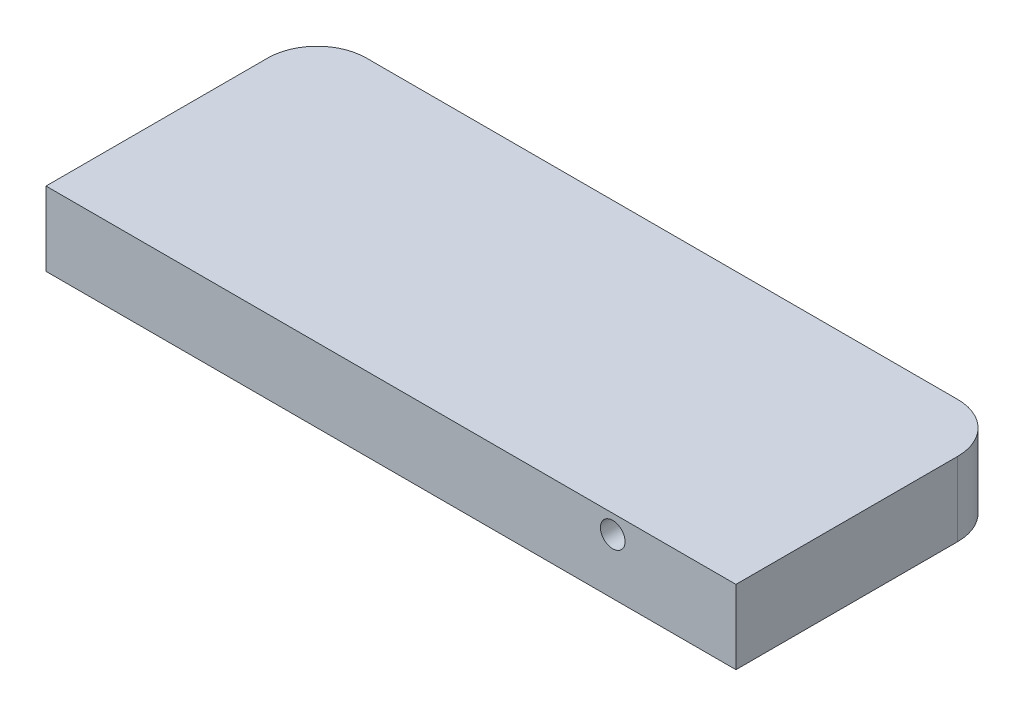
from build123d import *

# Parameters (mm, degrees)
BOSS_EXTRU_1_DEPTH      = 30
ESQUISSE2_R             = 5
ENL_V_MAT_EXTRU_1_DEPTH = 58


with BuildPart() as part:
    # Esquisse1 → Boss.-Extru.1 (new body)
    with BuildSketch(Plane(origin=(0, 0, 0), x_dir=(1, 0, 0), z_dir=(0, 1, 0))):
        with BuildLine():
            Line((0, 0), (280, 0))
            Line((280, 0), (280, 90))
            ThreePointArc((280, 90), (274.142135624, 104.142135624), (260, 110))
            Line((260, 110), (20, 110))
            ThreePointArc((20, 110), (5.857864376, 104.142135624), (0, 90))
            Line((0, 90), (0, 0))
        make_face()
    extrude(amount=-BOSS_EXTRU_1_DEPTH)

    # Esquisse2 → Enlèv. mat.-Extru.1 (cut)
    with BuildSketch(Plane.XY):
        with Locations((230, -7.5)):
            Circle(ESQUISSE2_R)
    extrude(amount=-ENL_V_MAT_EXTRU_1_DEPTH, mode=Mode.SUBTRACT)


solid = part.part
